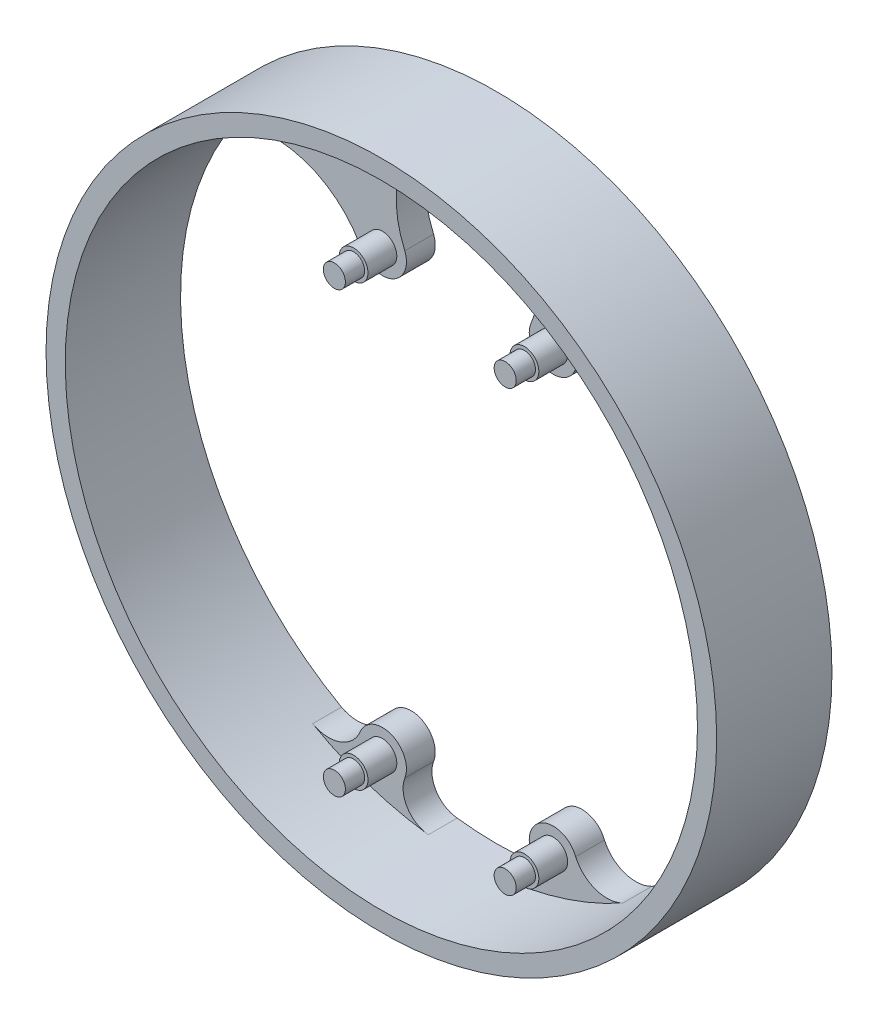
from build123d import *

# Parameters (mm, degrees)
ESQUISSE_CORPS_R   = 34.9
BOSS_EXTRU_1_DEPTH = 3
ESQUISSE5_R        = 1.5
BOSS_EXTRU_2_DEPTH = 3
ESQUISSE6_R        = 1.15
BOSS_EXTRU_3_DEPTH = 2
ESQUISSE7_R        = 34.9
ESQUISSE7_R_2      = 32.9
BOSS_EXTRU_4_DEPTH = 9


with BuildPart() as part:
    # Esquisse_corps → Boss.-Extru.1 (new body)
    with BuildSketch(Plane.XY):
        Circle(ESQUISSE_CORPS_R)
        with BuildLine():
            ThreePointArc((-11.220011679, -26.953884347), (-7.983884347, -25.529988321), (-6.559988321, -28.766115653))
            ThreePointArc((-6.559988321, -28.766115653), (-6.289235285, -31.30799577), (-4.108913196, -32.642408495))
            ThreePointArc((-4.108913196, -32.642408495), (0, -32.9), (4.108913196, -32.642408495))
            ThreePointArc((4.108913196, -32.642408495), (6.289235285, -31.30799577), (6.559988321, -28.766115653))
            ThreePointArc((6.559988321, -28.766115653), (7.983884347, -25.529988321), (11.220011679, -26.953884347))
            ThreePointArc((11.220011679, -26.953884347), (13.316969942, -28.87783046), (16.154521733, -28.660799493))
            ThreePointArc((16.154521733, -28.660799493), (32.305537105, -6.225935459), (25.64893396, 20.604421533))
            ThreePointArc((25.64893396, 20.604421533), (17.65423242, 21.86309032), (11.220011679, 16.953884347))
            ThreePointArc((11.220011679, 16.953884347), (7.983884347, 15.529988321), (6.559988321, 18.766115653))
            ThreePointArc((6.559988321, 18.766115653), (6.487068724, 27.321563828), (0, 32.9))
            ThreePointArc((0, 32.9), (-6.487068724, 27.321563828), (-6.559988321, 18.766115653))
            ThreePointArc((-6.559988321, 18.766115653), (-7.983884347, 15.529988321), (-11.220011679, 16.953884347))
            ThreePointArc((-11.220011679, 16.953884347), (-17.65423242, 21.86309032), (-25.64893396, 20.604421533))
            ThreePointArc((-25.64893396, 20.604421533), (-32.305537105, -6.225935459), (-16.154521733, -28.660799493))
            ThreePointArc((-16.154521733, -28.660799493), (-13.316969942, -28.87783046), (-11.220011679, -26.953884347))
        make_face(mode=Mode.SUBTRACT)
    extrude(amount=BOSS_EXTRU_1_DEPTH)

    # Esquisse5 → Boss.-Extru.2 (add)
    with BuildSketch(Plane.XY.offset(3)):
        with Locations((-8.89, 17.86)):
            Circle(ESQUISSE5_R)
        with Locations((-8.89, -27.86)):
            Circle(ESQUISSE5_R)
        with Locations(Location((8.89, -27.86, 0), (0, 0, 180))):
            Circle(ESQUISSE5_R)
        with Locations(Location((8.89, 17.86, 0), (0, 0, 180))):
            Circle(ESQUISSE5_R)
    extrude(amount=BOSS_EXTRU_2_DEPTH)

    # Esquisse6 → Boss.-Extru.3 (add)
    with BuildSketch(Plane.XY.offset(6)):
        with Locations((-8.89, 17.86)):
            Circle(ESQUISSE6_R)
        with Locations((-8.89, -27.86)):
            Circle(ESQUISSE6_R)
        with Locations(Location((8.89, -27.86, 0), (0, 0, 180))):
            Circle(ESQUISSE6_R)
        with Locations(Location((8.89, 17.86, 0), (0, 0, 180))):
            Circle(ESQUISSE6_R)
    extrude(amount=BOSS_EXTRU_3_DEPTH)

    # Esquisse7 → Boss.-Extru.4 (add)
    with BuildSketch(Plane.XY.offset(3)):
        Circle(ESQUISSE7_R)
        with Locations(Location((0, 0, 0), (0, 0, 141.224227635))):
            Circle(ESQUISSE7_R_2, mode=Mode.SUBTRACT)
    extrude(amount=BOSS_EXTRU_4_DEPTH)


solid = part.part
